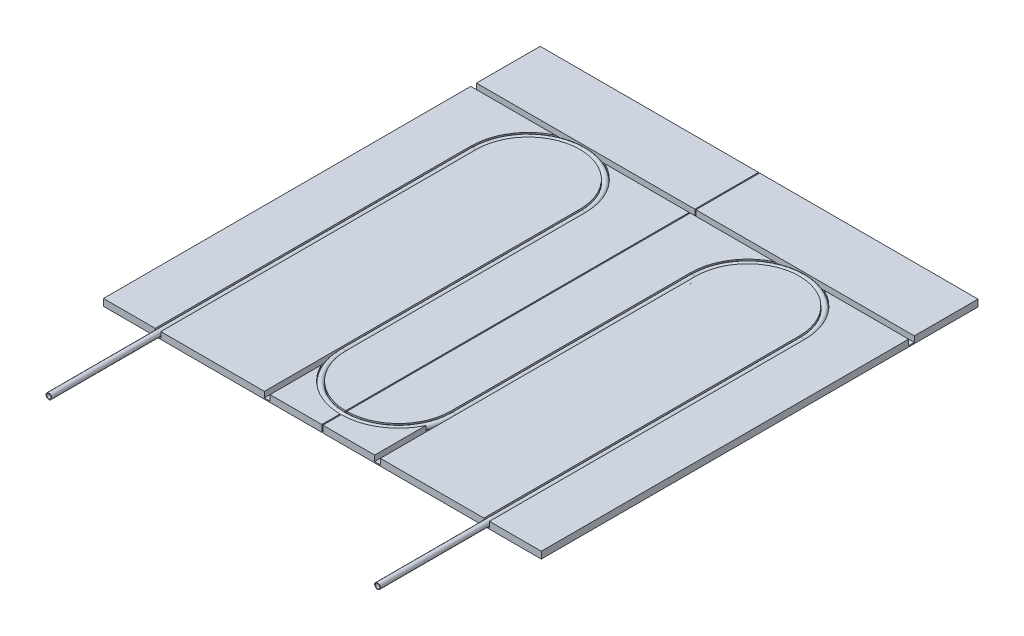
from build123d import *

# Parameters (mm, degrees)
SKETCH1_W           = 609.6
SKETCH1_H           = 1219.2
BOSS_EXTRUDE1_DEPTH = 19.05
CUT_EXTRUDE1_DEPTH  = 15.875
SKETCH3_W           = 609.6
SKETCH3_H           = 15.875
CUT_EXTRUDE2_DEPTH  = 15.875
CUT_EXTRUDE3_DEPTH  = 15.875
SKETCH6_R           = 7.9375
SKETCH6_R_2         = 6.35
SKETCH8_R           = 7.9375
SKETCH8_R_2         = 6.35
BOSS_EXTRUDE2_DEPTH = 304.8


with BuildPart() as part:
    # Sketch1 → Boss-Extrude1 (new body)
    with BuildSketch(Plane(origin=(0, 0, 0), x_dir=(1, 0, 0), z_dir=(0, 1, 0))):
        with Locations((-306.3875, 0)):
            Rectangle(SKETCH1_W, SKETCH1_H)
    extrude(amount=BOSS_EXTRUDE1_DEPTH)

    # Sketch2 → Cut-Extrude1 (cut)
    with BuildSketch(Plane(origin=(0, 19.05, 0), x_dir=(1, 0, 0), z_dir=(0, 1, 0))):
        with BuildLine():
            Line((-466.725, -609.6), (-450.85, -609.6))
            Line((-450.85, -609.6), (-450.85, 271.4625))
            ThreePointArc((-450.85, 271.4625), (-306.3875, 415.925), (-161.925, 271.4625))
            Line((-161.925, 271.4625), (-161.925, -609.6))
            Line((-161.925, -609.6), (-146.05, -609.6))
            Line((-146.05, -609.6), (-146.05, 271.4625))
            ThreePointArc((-146.05, 271.4625), (-306.3875, 431.8), (-466.725, 271.4625))
            Line((-466.725, 271.4625), (-466.725, -609.6))
        make_face()
    extrude(amount=-CUT_EXTRUDE1_DEPTH, mode=Mode.SUBTRACT)

    # Sketch3 → Cut-Extrude2 (cut)
    with BuildSketch(Plane(origin=(0, 19.05, 0), x_dir=(1, 0, 0), z_dir=(0, 1, 0))):
        with Locations((-306.3875, 423.8625)):
            Rectangle(SKETCH3_W, SKETCH3_H)
    extrude(amount=-CUT_EXTRUDE2_DEPTH, mode=Mode.SUBTRACT)


with BuildPart() as body_2:
    # Mirror3: mirrored copy
    add(part.part.mirror(Plane(origin=(0, 0, 0), x_dir=(0, 0, 1), z_dir=(1, 0, 0))))


with BuildPart() as cut_extrude3_tool:
    # Sketch5 → Cut-Extrude3 (new body)
    with BuildSketch(Plane(origin=(0, 19.05, 0), x_dir=(1, 0, 0), z_dir=(0, 1, 0))):
        with BuildLine():
            Line((-161.925, -396.875), (-146.05, -396.875))
            ThreePointArc((-146.05, -396.875), (0, -542.925), (146.05, -396.875))
            Line((146.05, -396.875), (161.925, -396.875))
            ThreePointArc((161.925, -396.875), (0, -558.8), (-161.925, -396.875))
        make_face()
    extrude(amount=-CUT_EXTRUDE3_DEPTH)


with BuildPart() as part_1:
    add(part.part)

    # Cut-Extrude3: cut by cut_extrude3_tool
    add(cut_extrude3_tool.part, mode=Mode.SUBTRACT)


with BuildPart() as body_2_1:
    add(body_2.part)

    # Cut-Extrude3: cut by cut_extrude3_tool
    add(cut_extrude3_tool.part, mode=Mode.SUBTRACT)


with BuildPart() as body_3:
    # Sweep1: sweep along a path in Sketch7
    with BuildLine(Plane(origin=(0, 11.1125, 0), x_dir=(1, 0, 0), z_dir=(0, 1, 0))) as sweep1_path:
        Line((-458.7875, -609.6), (-458.7875, 271.4625))
        ThreePointArc((-458.7875, 271.4625), (-306.3875, 423.8625), (-153.9875, 271.4625))
        Line((-153.9875, 271.4625), (-153.9875, -396.875))
        ThreePointArc((-153.9875, -396.875), (0, -550.8625), (153.9875, -396.875))
        Line((153.9875, -396.875), (153.9875, 271.4625))
        ThreePointArc((153.9875, 271.4625), (306.3875, 423.8625), (458.7875, 271.4625))
        Line((458.7875, 271.4625), (458.7875, -609.6))
    # Sketch6 → Sweep1 (sweep)
    with BuildSketch(Plane.XY.offset(609.6)):
        with Locations((-458.7875, 11.1125)):
            Circle(SKETCH6_R)
        with Locations((-458.7875, 11.1125)):
            Circle(SKETCH6_R_2, mode=Mode.SUBTRACT)
    sweep(path=sweep1_path.line)

    # Sketch8 → Boss-Extrude2 (add)
    # profile 1 of 2: a face of its own
    with BuildSketch(Plane.XY.offset(609.6)):
        with Locations((-458.7875, 11.1125)):
            Circle(SKETCH8_R)
        with Locations((-458.7875, 11.1125)):
            Circle(SKETCH8_R_2, mode=Mode.SUBTRACT)
    # profile 2 of 2: a face of its own
    with BuildSketch(Plane.XY.offset(609.6)):
        with Locations((458.7875, 11.1125)):
            Circle(SKETCH8_R)
        with Locations((458.7875, 11.1125)):
            Circle(SKETCH8_R_2, mode=Mode.SUBTRACT)
    extrude(amount=BOSS_EXTRUDE2_DEPTH)


solid = Compound([part_1.part, body_2_1.part, body_3.part])
